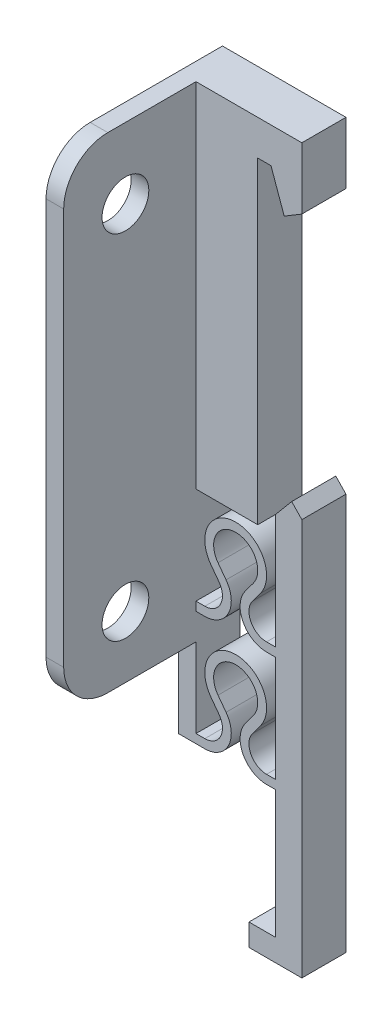
from build123d import *

# Parameters (mm, degrees)
BOSS_EXTRUDE1_DEPTH = 5
SKETCH2_W           = 20
SKETCH2_H           = 55
BOSS_EXTRUDE2_DEPTH = 2
FILLET1_R           = 5
CUT_EXTRUDE1_REACH  = 59.446
SKETCH3_R           = 2.65


with BuildPart() as part:
    # Sketch1 → Boss-Extrude1 (new body)
    with BuildSketch(Plane.XY):
        with BuildLine():
            Line((0, 30), (12, 30))
            Line((12, 30), (14, 30))
            Line((14, 30), (14, 23))
            Line((14, 23), (12, 21.8))
            Line((12, 21.8), (10.5, 26))
            Line((10.5, 26), (9, 26))
            Line((9, 26), (9, -10))
            Line((9, -10), (2, -10))
            Line((2, -10), (2, -12))
            Line((2, -12), (2, -13.5))
            Line((2, -13.5), (2, -21))
            Line((2, -21), (3, -21))
            ThreePointArc((3, -21), (4.787066885, -19.89799329), (4.604774071, -17.806391949))
            Line((4.604774071, -17.806391949), (3.691645375, -16.578714862))
            ThreePointArc((3.691645375, -16.578714862), (6.5, -10.989900772), (9.308354625, -16.578714862))
            Line((9.308354625, -16.578714862), (8.395225929, -17.806391949))
            ThreePointArc((8.395225929, -17.806391949), (8.212933115, -19.89799329), (10, -21))
            Line((10, -21), (11, -21))
            Line((11, -21), (11, -19.8))
            Line((11, -19.8), (11, -18.3))
            Line((11, -18.3), (11, -8))
            Line((11, -8), (12.846019189, -5.8))
            Line((12.846019189, -5.8), (14, -7))
            Line((14, -7), (14, -37))
            Line((14, -37), (14, -40))
            Line((14, -40), (14, -43))
            Line((14, -43), (14, -52))
            Line((14, -52), (8, -52))
            Line((8, -52), (8, -49.5))
            Line((8, -49.5), (11, -49.5))
            Line((11, -49.5), (11, -41.5))
            Line((11, -41.5), (11, -40))
            Line((11, -40), (11, -35))
            Line((11, -35), (10, -35))
            ThreePointArc((10, -35), (7.319399673, -33.346989935), (7.592838893, -30.209587923))
            Line((7.592838893, -30.209587923), (8.505967589, -28.981910837))
            ThreePointArc((8.505967589, -28.981910837), (6.5, -24.989900772), (4.494032411, -28.981910837))
            Line((4.494032411, -28.981910837), (5.407161107, -30.209587923))
            ThreePointArc((5.407161107, -30.209587923), (5.680600328, -33.346989935), (3, -35))
            Line((3, -35), (2, -35))
            Line((2, -35), (0, -35))
            Line((0, -35), (0, 30))
        make_face()
        with BuildLine():
            Line((3, -22), (2, -22))
            Line((2, -22), (2, -33.5))
            Line((2, -33.5), (2, -34))
            Line((2, -34), (3, -34))
            ThreePointArc((3, -34), (4.787066885, -32.89799329), (4.604774071, -30.806391949))
            Line((4.604774071, -30.806391949), (3.691645375, -29.578714862))
            ThreePointArc((3.691645375, -29.578714862), (6.5, -23.989900772), (9.308354625, -29.578714862))
            Line((9.308354625, -29.578714862), (8.395225929, -30.806391949))
            ThreePointArc((8.395225929, -30.806391949), (8.212933115, -32.89799329), (10, -34))
            Line((10, -34), (11, -34))
            Line((11, -34), (11, -22))
            Line((11, -22), (10, -22))
            ThreePointArc((10, -22), (7.319399672, -20.346989935), (7.592838893, -17.209587923))
            Line((7.592838893, -17.209587923), (8.505967589, -15.981910837))
            ThreePointArc((8.505967589, -15.981910837), (6.5, -11.989900772), (4.494032411, -15.981910837))
            Line((4.494032411, -15.981910837), (5.407161107, -17.209587923))
            ThreePointArc((5.407161107, -17.209587923), (5.680600328, -20.346989935), (3, -22))
        make_face(mode=Mode.SUBTRACT)
    extrude(amount=BOSS_EXTRUDE1_DEPTH)

    # Sketch2 → Boss-Extrude2 (add)
    with BuildSketch(Plane(origin=(0, 0, 0), x_dir=(0, 0, -1), z_dir=(1, 0, 0))):
        with Locations((-10, 2.5)):
            Rectangle(SKETCH2_W, SKETCH2_H)
    extrude(amount=BOSS_EXTRUDE2_DEPTH)

    # Fillet1
    fillet1_edges = [part.edges().sort_by_distance(p)[0] for p in [
        (1, 30, 20),
        (1, -25, 20),
    ]]
    fillet(fillet1_edges, radius=FILLET1_R)

    # Sketch3 → Cut-Extrude1 (cut, up to next)
    with BuildSketch(Plane(origin=(0, 0, 0), x_dir=(0, 0, -1), z_dir=(1, 0, 0)), mode=Mode.PRIVATE) as cut_extrude1_sk1:
        with Locations(Location((-13, 22, 0), (0, 0, 270))):
            Circle(SKETCH3_R)
    cut_extrude1_tool1 = extrude(cut_extrude1_sk1.sketch, amount=CUT_EXTRUDE1_REACH, mode=Mode.PRIVATE) & part.part
    # Sketch3 → Cut-Extrude1 (cut, up to next)
    with BuildSketch(Plane(origin=(0, 0, 0), x_dir=(0, 0, -1), z_dir=(1, 0, 0)), mode=Mode.PRIVATE) as cut_extrude1_sk2:
        with Locations(Location((-13, -18, 0), (0, 0, 270))):
            Circle(SKETCH3_R)
    cut_extrude1_tool2 = extrude(cut_extrude1_sk2.sketch, amount=CUT_EXTRUDE1_REACH, mode=Mode.PRIVATE) & part.part
    add(cut_extrude1_tool1.solids().sort_by_distance((0, 22, 13))[0], mode=Mode.SUBTRACT)
    add(cut_extrude1_tool2.solids().sort_by_distance((0, -18, 13))[0], mode=Mode.SUBTRACT)


solid = part.part
